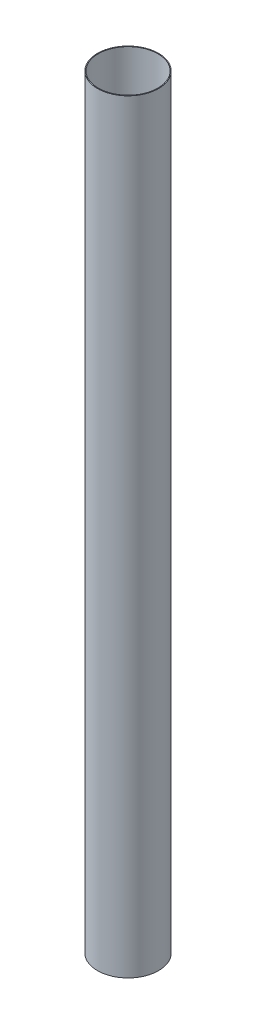
from build123d import *

# Parameters (mm, degrees)
SKETCH1_R           = 50.8
SKETCH1_R_2         = 49.53
BOSS_EXTRUDE1_DEPTH = 1270


with BuildPart() as part:
    # Sketch1 → Boss-Extrude1 (new body)
    with BuildSketch(Plane(origin=(0, 0, 0), x_dir=(1, 0, 0), z_dir=(0, 1, 0))):
        with Locations(Location((0, 0, 0), (0, 0, 90))):
            Circle(SKETCH1_R)
        with Locations(Location((0, 0, 0), (0, 0, 90))):
            Circle(SKETCH1_R_2, mode=Mode.SUBTRACT)
    extrude(amount=BOSS_EXTRUDE1_DEPTH)


solid = part.part
